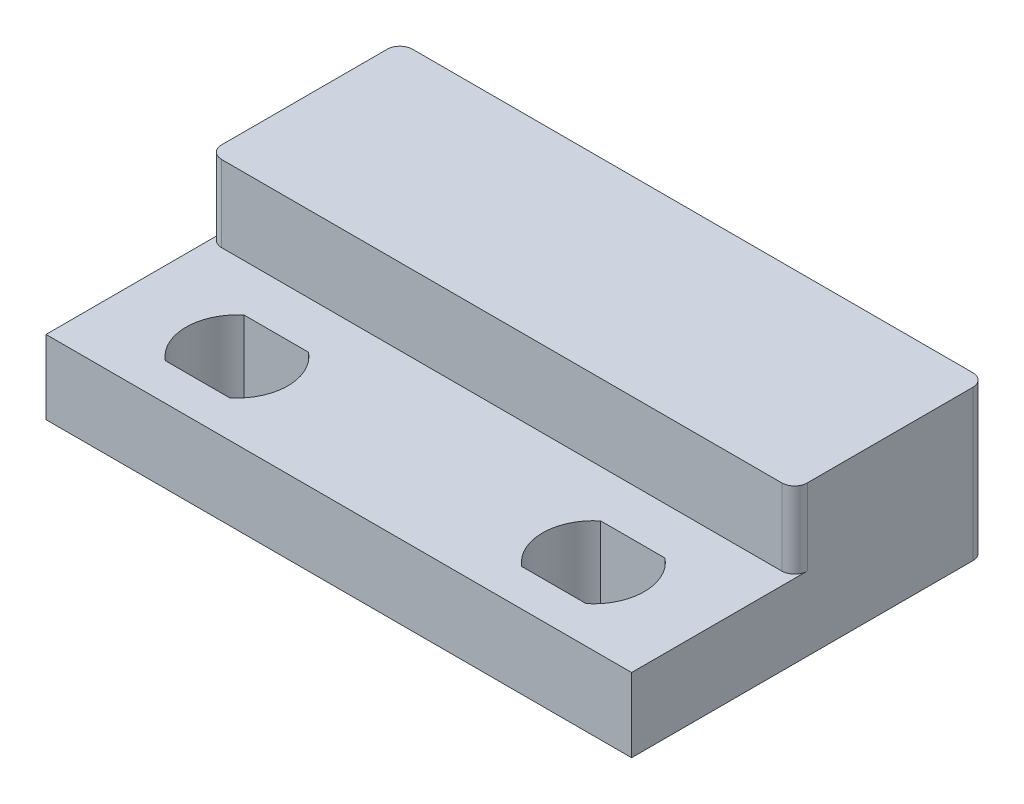
from build123d import *

# Parameters (mm, degrees)
BOSS_EXTRUDE1_DEPTH = 11.5
CUT_EXTRUDE1_DEPTH  = 16.62921943
FILLET1_R           = 0.5


with BuildPart() as part:
    # Sketch1 → Boss-Extrude1 (new, symmetric)
    with BuildSketch(Plane(origin=(0, 0, 0), x_dir=(0, 0, -1), z_dir=(1, 0, 0))):
        Polygon((-10.15, -1.45), (3.75, -1.45), (3.75, 4.45), (-3.75, 4.45), (-3.75, 1.45), (-10.15, 1.45), align=None)
    extrude(amount=BOSS_EXTRUDE1_DEPTH, both=True)

    # Sketch2 → Cut-Extrude1 (cut, through all)
    with BuildSketch(Plane(origin=(0, 1.45, 0), x_dir=(1, 0, 0), z_dir=(0, 1, 0))):
        with BuildLine():
            Line((-8.263922466, -5.6), (-5.736077534, -5.6))
            ThreePointArc((-5.736077534, -5.6), (-5, -7.15), (-5.736077534, -8.7))
            Line((-5.736077534, -8.7), (-8.263922466, -8.7))
            ThreePointArc((-8.263922466, -8.7), (-9, -7.15), (-8.263922466, -5.6))
        make_face()
        with BuildLine():
            Line((5.736077534, -5.6), (8.263922466, -5.6))
            ThreePointArc((8.263922466, -5.6), (9, -7.15), (8.263922466, -8.7))
            Line((8.263922466, -8.7), (5.736077534, -8.7))
            ThreePointArc((5.736077534, -8.7), (5, -7.15), (5.736077534, -5.6))
        make_face()
    extrude(amount=-CUT_EXTRUDE1_DEPTH, mode=Mode.SUBTRACT)

    # Fillet1
    fillet1_edges = [part.edges().sort_by_distance(p)[0] for p in [
        (11.5, 1.5, -3.75),
        (11.5, 2.95, 3.75),
        (-11.5, 2.95, 3.75),
        (-11.5, 1.5, -3.75),
    ]]
    fillet(fillet1_edges, radius=FILLET1_R)


solid = part.part
